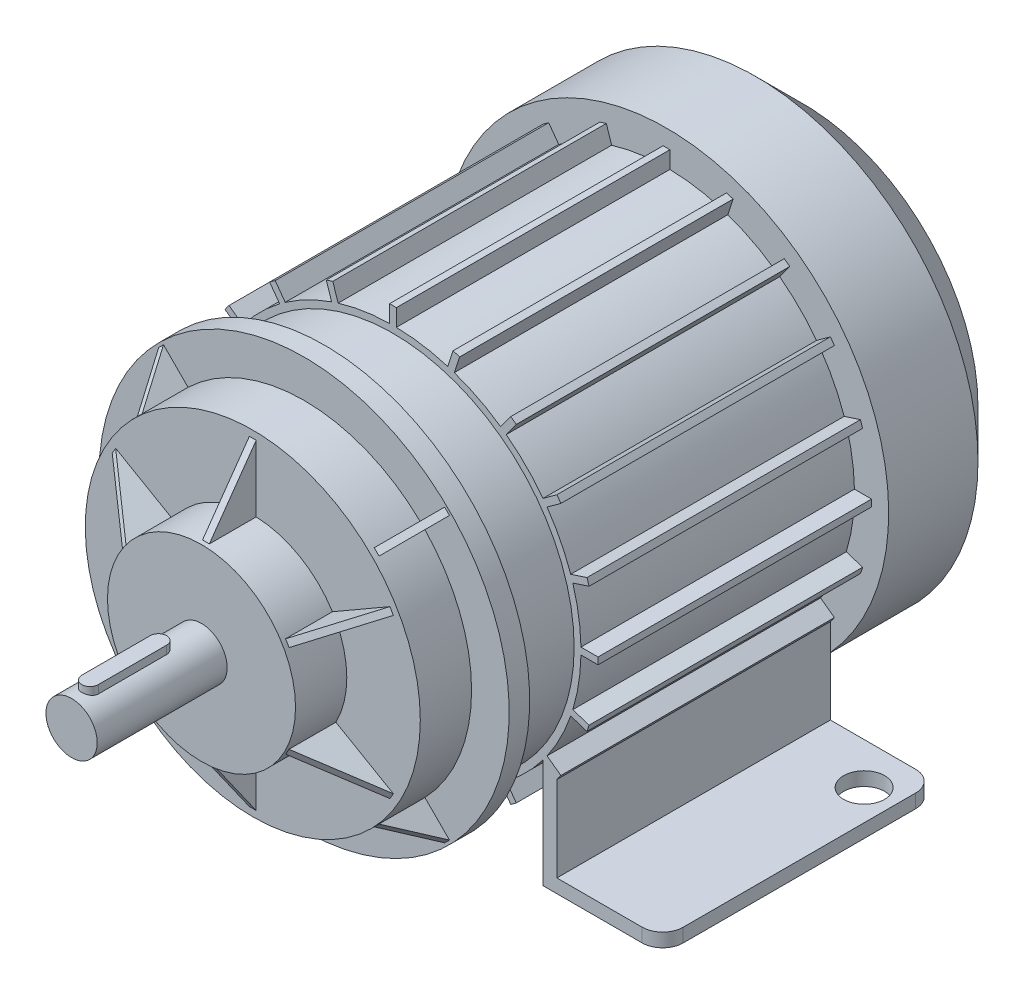
from build123d import *

# Parameters (mm, degrees)
SKETCH1_R           = 82.55
BOSS_EXTRUDE1_DEPTH = 50.8
CHAMFER1_SIZE       = 17.62
BOSS_EXTRUDE2_DEPTH = 101.6
BOSS_EXTRUDE8_DEPTH = 101.6
FILLET1_R           = 7.62
SKETCH4_R           = 67.31
BOSS_EXTRUDE3_DEPTH = 25.4
SKETCH5_R           = 76.2
BOSS_EXTRUDE4_DEPTH = 7.62
SKETCH6_R           = 62.23
BOSS_EXTRUDE5_DEPTH = 19.05
SKETCH8_R           = 34.925
BOSS_EXTRUDE6_DEPTH = 19.05
RIB9_REACH          = 260.489
SKETCH15_WALL_W     = 555.141952692
SKETCH15_WALL_H     = 2.54
CIRPATTERN1_COUNT   = 6
RIB10_REACH         = 260.489
SKETCH17_WALL_W     = 544.664764874
SKETCH17_WALL_H     = 2.54
CIRPATTERN2_COUNT   = 4
SKETCH18_R          = 9.525
BOSS_EXTRUDE7_DEPTH = 48.26
SKETCH20_R          = 7.622776323
CUT_EXTRUDE1_DEPTH  = 331.925387555
BOSS_EXTRUDE9_DEPTH = 12.065


with BuildPart() as part:
    # Sketch1 → Boss-Extrude1 (new body)
    with BuildSketch(Plane.XY):
        Circle(SKETCH1_R)
    extrude(amount=BOSS_EXTRUDE1_DEPTH)

    # Chamfer1
    chamfer1_edges = [part.edges().sort_by_distance(p)[0] for p in [
        (-82.55, 0, 0),
    ]]
    chamfer(chamfer1_edges, length=CHAMFER1_SIZE)

    # Sketch2 → Boss-Extrude2 (add)
    with BuildSketch(Plane.XY.offset(50.8)):
        with BuildLine():
            Line((1.27, 76.189415932), (1.27, 69.838453591))
            ThreePointArc((1.27, 69.838453591), (10.926947383, 68.990030591), (20.373427245, 66.812767959))
            Line((20.373427245, 66.812767959), (22.335982539, 72.852892077))
            ThreePointArc((22.335982539, 72.852892077), (23.547094971, 72.470506542), (24.75166609, 72.067988912))
            Line((24.75166609, 72.067988912), (22.789110796, 66.027864793))
            ThreePointArc((22.789110796, 66.027864793), (31.711236407, 62.236805715), (40.022561481, 57.246983086))
            Line((40.022561481, 57.246983086), (43.755563483, 62.385019551))
            ThreePointArc((43.755563483, 62.385019551), (44.789236225, 61.647094971), (45.810466648, 60.89204501))
            Line((45.810466648, 60.89204501), (42.077464647, 55.754008546))
            ThreePointArc((42.077464647, 55.754008546), (49.391408666, 49.391408666), (55.754008546, 42.077464647))
            Line((55.754008546, 42.077464647), (60.89204501, 45.810466648))
            ThreePointArc((60.89204501, 45.810466648), (61.647094971, 44.789236225), (62.385019551, 43.755563483))
            Line((62.385019551, 43.755563483), (57.246983086, 40.022561481))
            ThreePointArc((57.246983086, 40.022561481), (62.236805715, 31.711236407), (66.027864793, 22.789110796))
            Line((66.027864793, 22.789110796), (72.067988912, 24.75166609))
            ThreePointArc((72.067988912, 24.75166609), (72.470506542, 23.547094971), (72.852892077, 22.335982539))
            Line((72.852892077, 22.335982539), (66.812767959, 20.373427245))
            ThreePointArc((66.812767959, 20.373427245), (68.990030591, 10.926947383), (69.838453591, 1.27))
            Line((69.838453591, 1.27), (76.189415932, 1.27))
            ThreePointArc((76.189415932, 1.27), (76.2, 0), (76.189415932, -1.27))
            Line((76.189415932, -1.27), (69.838453591, -1.27))
            ThreePointArc((69.838453591, -1.27), (68.990030591, -10.926947383), (66.812767959, -20.373427245))
            Line((66.812767959, -20.373427245), (72.852892077, -22.335982539))
            ThreePointArc((72.852892077, -22.335982539), (72.470506542, -23.547094971), (72.067988912, -24.75166609))
            Line((72.067988912, -24.75166609), (66.027864793, -22.789110796))
            ThreePointArc((66.027864793, -22.789110796), (62.236805715, -31.711236407), (57.246983086, -40.022561481))
            Line((57.246983086, -40.022561481), (62.385019551, -43.755563483))
            ThreePointArc((62.385019551, -43.755563483), (61.647094971, -44.789236225), (60.89204501, -45.810466648))
            Line((60.89204501, -45.810466648), (55.754008546, -42.077464647))
            ThreePointArc((55.754008546, -42.077464647), (49.391408666, -49.391408666), (42.077464647, -55.754008546))
            Line((42.077464647, -55.754008546), (45.810466648, -60.89204501))
            ThreePointArc((45.810466648, -60.89204501), (44.789236225, -61.647094971), (43.755563483, -62.385019551))
            Line((43.755563483, -62.385019551), (40.022561481, -57.246983086))
            ThreePointArc((40.022561481, -57.246983086), (31.711236407, -62.236805715), (22.789110796, -66.027864793))
            Line((22.789110796, -66.027864793), (24.75166609, -72.067988912))
            ThreePointArc((24.75166609, -72.067988912), (23.547094971, -72.470506542), (22.335982539, -72.852892077))
            Line((22.335982539, -72.852892077), (20.373427245, -66.812767959))
            ThreePointArc((20.373427245, -66.812767959), (10.926947383, -68.990030591), (1.27, -69.838453591))
            Line((1.27, -69.838453591), (1.27, -76.189415932))
            ThreePointArc((1.27, -76.189415932), (0, -76.2), (-1.27, -76.189415932))
            Line((-1.27, -76.189415932), (-1.27, -69.838453591))
            ThreePointArc((-1.27, -69.838453591), (-10.926947383, -68.990030591), (-20.373427245, -66.812767959))
            Line((-20.373427245, -66.812767959), (-22.335982539, -72.852892077))
            ThreePointArc((-22.335982539, -72.852892077), (-23.547094971, -72.470506542), (-24.75166609, -72.067988912))
            Line((-24.75166609, -72.067988912), (-22.789110796, -66.027864793))
            ThreePointArc((-22.789110796, -66.027864793), (-31.711236407, -62.236805715), (-40.022561481, -57.246983086))
            Line((-40.022561481, -57.246983086), (-43.755563483, -62.385019551))
            ThreePointArc((-43.755563483, -62.385019551), (-44.789236225, -61.647094971), (-45.810466648, -60.89204501))
            Line((-45.810466648, -60.89204501), (-42.077464647, -55.754008546))
            ThreePointArc((-42.077464647, -55.754008546), (-49.391408666, -49.391408666), (-55.754008546, -42.077464647))
            Line((-55.754008546, -42.077464647), (-60.89204501, -45.810466648))
            ThreePointArc((-60.89204501, -45.810466648), (-61.647094971, -44.789236225), (-62.385019551, -43.755563483))
            Line((-62.385019551, -43.755563483), (-57.246983086, -40.022561481))
            ThreePointArc((-57.246983086, -40.022561481), (-62.236805715, -31.711236407), (-66.027864793, -22.789110796))
            Line((-66.027864793, -22.789110796), (-72.067988912, -24.75166609))
            ThreePointArc((-72.067988912, -24.75166609), (-72.470506542, -23.547094971), (-72.852892077, -22.335982539))
            Line((-72.852892077, -22.335982539), (-66.812767959, -20.373427245))
            ThreePointArc((-66.812767959, -20.373427245), (-68.990030591, -10.926947383), (-69.838453591, -1.27))
            Line((-69.838453591, -1.27), (-76.189415932, -1.27))
            ThreePointArc((-76.189415932, -1.27), (-76.2, 0), (-76.189415932, 1.27))
            Line((-76.189415932, 1.27), (-69.838453591, 1.27))
            ThreePointArc((-69.838453591, 1.27), (-68.990030591, 10.926947383), (-66.812767959, 20.373427245))
            Line((-66.812767959, 20.373427245), (-72.852892077, 22.335982539))
            ThreePointArc((-72.852892077, 22.335982539), (-72.470506542, 23.547094971), (-72.067988912, 24.75166609))
            Line((-72.067988912, 24.75166609), (-66.027864793, 22.789110796))
            ThreePointArc((-66.027864793, 22.789110796), (-62.236805715, 31.711236407), (-57.246983086, 40.022561481))
            Line((-57.246983086, 40.022561481), (-62.385019551, 43.755563483))
            ThreePointArc((-62.385019551, 43.755563483), (-61.647094971, 44.789236225), (-60.89204501, 45.810466648))
            Line((-60.89204501, 45.810466648), (-55.754008546, 42.077464647))
            ThreePointArc((-55.754008546, 42.077464647), (-49.391408666, 49.391408666), (-42.077464647, 55.754008546))
            Line((-42.077464647, 55.754008546), (-45.810466648, 60.89204501))
            ThreePointArc((-45.810466648, 60.89204501), (-44.789236225, 61.647094971), (-43.755563483, 62.385019551))
            Line((-43.755563483, 62.385019551), (-40.022561481, 57.246983086))
            ThreePointArc((-40.022561481, 57.246983086), (-31.711236407, 62.236805715), (-22.789110796, 66.027864793))
            Line((-22.789110796, 66.027864793), (-24.75166609, 72.067988912))
            ThreePointArc((-24.75166609, 72.067988912), (-23.547094971, 72.470506542), (-22.335982539, 72.852892077))
            Line((-22.335982539, 72.852892077), (-20.373427245, 66.812767959))
            ThreePointArc((-20.373427245, 66.812767959), (-10.926947383, 68.990030591), (-1.27, 69.838453591))
            Line((-1.27, 69.838453591), (-1.27, 76.189415932))
            ThreePointArc((-1.27, 76.189415932), (0, 76.2), (1.27, 76.189415932))
        make_face()
    extrude(amount=BOSS_EXTRUDE2_DEPTH)

    # Sketch19 → Boss-Extrude8 (add)
    with BuildSketch(Plane.XY.offset(50.8)):
        Polygon((60.89204501, -45.810466648), (55.754008546, -42.077464647), (55.754008546, -82.55), (100.204008546, -82.55), (100.204008546, -77.47), (60.89204501, -77.47), align=None)
        Polygon((-100.204008546, -82.55), (-100.204008546, -77.47), (-60.89204501, -77.47), (-60.89204501, -45.810466648), (-55.754008546, -42.077464647), (-55.754008546, -82.55), align=None)
    extrude(amount=BOSS_EXTRUDE8_DEPTH)

    # Fillet1
    fillet1_edges = [part.edges().sort_by_distance(p)[0] for p in [
        (100.204008546, -80.01, 50.8),
        (100.204008546, -80.01, 152.4),
        (-100.204008546, -80.01, 50.8),
        (-100.204008546, -80.01, 152.4),
    ]]
    fillet(fillet1_edges, radius=FILLET1_R)

    # Sketch4 → Boss-Extrude3 (add)
    with BuildSketch(Plane.XY.offset(152.4)):
        Circle(SKETCH4_R)
    extrude(amount=BOSS_EXTRUDE3_DEPTH)

    # Sketch5 → Boss-Extrude4 (add)
    with BuildSketch(Plane.XY.offset(177.8)):
        with Locations(Location((0, 0, 0), (0, 0, 180))):
            Circle(SKETCH5_R)
    extrude(amount=BOSS_EXTRUDE4_DEPTH)

    # Sketch6 → Boss-Extrude5 (add)
    with BuildSketch(Plane.XY.offset(185.42)):
        with Locations(Location((0, 0, 0), (0, 0, 180))):
            Circle(SKETCH6_R)
    extrude(amount=BOSS_EXTRUDE5_DEPTH)

    # Sketch8 → Boss-Extrude6 (add)
    with BuildSketch(Plane.XY.offset(204.47)):
        with Locations(Location((0, 0, 0), (0, 0, 180))):
            Circle(SKETCH8_R)
    extrude(amount=BOSS_EXTRUDE6_DEPTH)

    # Sketch15 wall → Rib9 (add, up to next)
    with BuildSketch(Plane(origin=(0, 47.36289338, 213.085576844), x_dir=(0, 0.816701447403, -0.577060435146), z_dir=(0, 0.577060435146, 0.816701447403)), mode=Mode.PRIVATE) as rib9_sk1:
        Rectangle(SKETCH15_WALL_W, SKETCH15_WALL_H)
    rib9_tool1 = extrude(rib9_sk1.sketch, amount=-RIB9_REACH, mode=Mode.PRIVATE) - part.part
    rib9 = rib9_tool1.solids().sort_by_distance((0, 47.36289338, 213.085576844))[0]
    add(rib9)

    # CirPattern1: Rib9 ×6 about axis
    cirpattern1_axis = Axis((0, 0, 0), (0, 0, 1))
    for i in range(1, CIRPATTERN1_COUNT):
        add(rib9.rotate(cirpattern1_axis, i * 360 / CIRPATTERN1_COUNT))

    # Sketch17 wall → Rib10 (add, up to next)
    with BuildSketch(Plane(origin=(48.403249375, 48.403249375, 194.2264389), x_dir=(0.426543801053, 0.426543801053, -0.797571797124), z_dir=(0.563968426229, 0.563968426229, 0.603224028395)), mode=Mode.PRIVATE) as rib10_sk1:
        Rectangle(SKETCH17_WALL_W, SKETCH17_WALL_H)
    rib10_tool1 = extrude(rib10_sk1.sketch, amount=-RIB10_REACH, mode=Mode.PRIVATE) - part.part
    rib10 = rib10_tool1.solids().sort_by_distance((48.403249375, 48.403249375, 194.2264389))[0]
    add(rib10)

    # CirPattern2: Rib10 ×4 about axis
    cirpattern2_axis = Axis((0, 0, 0), (0, 0, 1))
    for i in range(1, CIRPATTERN2_COUNT):
        add(rib10.rotate(cirpattern2_axis, i * 360 / CIRPATTERN2_COUNT))

    # Sketch18 → Boss-Extrude7 (add)
    with BuildSketch(Plane.XY.offset(223.52)):
        with Locations(Location((0, 0, 0), (0, 0, 180))):
            Circle(SKETCH18_R)
    extrude(amount=BOSS_EXTRUDE7_DEPTH)

    # Sketch20 → Cut-Extrude1 (cut, through all)
    with BuildSketch(Plane(origin=(0, -77.47, 0), x_dir=(1, 0, 0), z_dir=(0, 1, 0))):
        with Locations(Location((88.859784665, -66.22767611, 0), (0, 0, 270))):
            Circle(SKETCH20_R)
    cut_extrude1 = extrude(amount=-CUT_EXTRUDE1_DEPTH, mode=Mode.SUBTRACT)

    # Mirror1: Cut-Extrude1 across plane
    add(cut_extrude1.mirror(Plane(origin=(0, 0, 0), x_dir=(0, 0, 1), z_dir=(1, 0, 0))), mode=Mode.SUBTRACT)

    # Sketch21 → Boss-Extrude9 (add)
    with BuildSketch(Plane(origin=(0, 0, 0), x_dir=(1, 0, 0), z_dir=(0, 1, 0))):
        with BuildLine():
            Line((-3.048, -264.922), (-3.048, -239.522))
            ThreePointArc((-3.048, -239.522), (0, -236.474), (3.048, -239.522))
            Line((3.048, -239.522), (3.048, -264.922))
            ThreePointArc((3.048, -264.922), (0, -267.97), (-3.048, -264.922))
        make_face()
    extrude(amount=BOSS_EXTRUDE9_DEPTH)


solid = part.part
